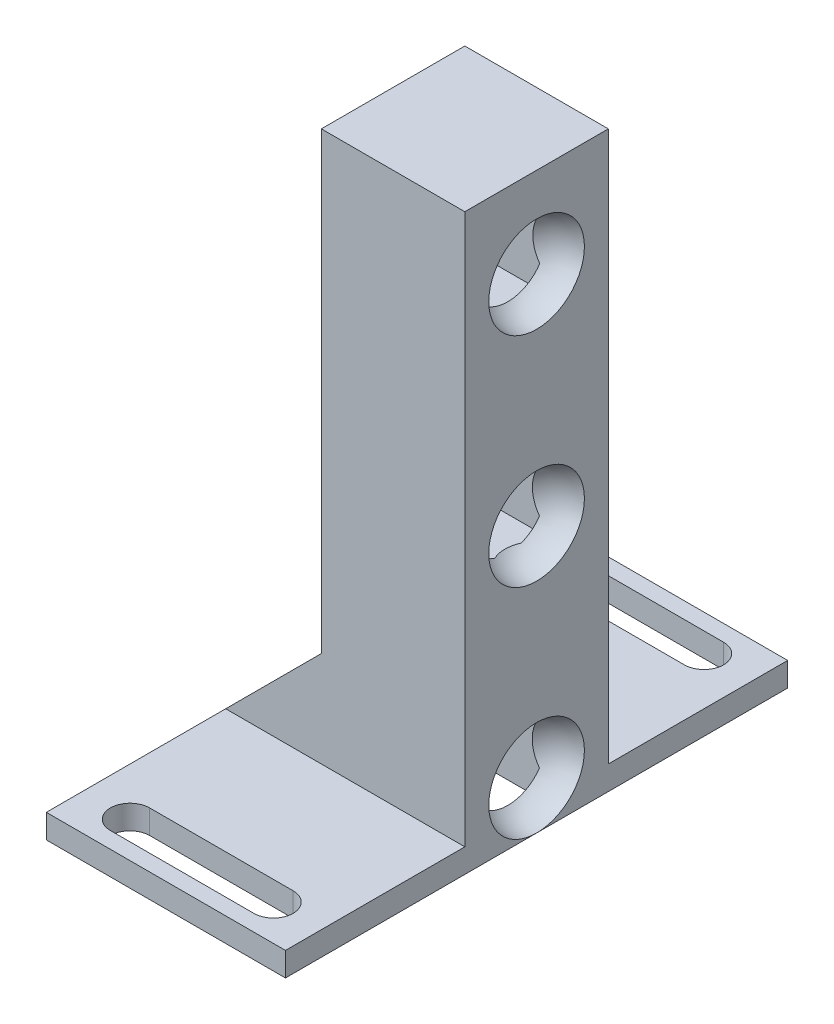
from build123d import *

# Parameters (mm, degrees)
SKETCH_1_W                      = 70
SKETCH_1_H                      = 105
EXTRUDE_1_DEPTH                 = 5
SKETCH_2_W                      = 30
SKETCH_2_H                      = 30
EXTRUDE_2_DEPTH                 = 120
EXTRUDE_3_REACH                 = 137.577
EXTRUDE_3_DIRECTION_2_REACH     = 137.577
SKETCH_8_R                      = 4.1
CUT_EXTRUDE_2_DEPTH             = 5
SKETCH_11_W                     = 20
SKETCH_11_H                     = 105
CUT_EXTRUDE_3_DEPTH             = 5
PATTERN_LINEAR_1_COUNT          = 3
PATTERN_LINEAR_1_PITCH          = 45.6
CUT_EXTRUDE_4_DEPTH             = 9
CUT_EXTRUDE_4_DEPTH_BACK        = 136.57746863
SKETCH_14_W                     = 13.2
SKETCH_14_H                     = 24
PATTERN_LINEAR_3_COUNT          = 2
PATTERN_LINEAR_3_PITCH          = 30
SKETCH_15_W                     = 30
SKETCH_15_H                     = 8.2
CUT_EXTRUDE_5_DEPTH             = 5
MIRROR_4_COPY_1_SKETCH_R        = 4.1
MIRROR_4_COPY_1_DEPTH           = 5
MIRROR_4_COPY_2_SKETCH_R        = 4.1
MIRROR_4_COPY_2_DEPTH           = 5
CUT_EXTRUDE_6_REACH             = 137.577
SKETCH_17_W                     = 13.2
SKETCH_17_H                     = 18
CUT_EXTRUDE_6_DIRECTION_2_DEPTH = 9
CUT_EXTRUDE_7_DEPTH             = 9
CUT_EXTRUDE_7_DEPTH_BACK        = 15
SKETCH_18_W                     = 13.2
SKETCH_18_H                     = 15


with BuildPart() as part:
    # 草图1 → 凸台-拉伸1 (new body)
    with BuildSketch(Plane(origin=(0, 0, 0), x_dir=(1, 0, 0), z_dir=(0, 1, 0))):
        Rectangle(SKETCH_1_W, SKETCH_1_H)
    extrude(amount=EXTRUDE_1_DEPTH)

    # 草图2 → 凸台-拉伸2 (add)
    with BuildSketch(Plane(origin=(0, 0, 0), x_dir=(1, 0, 0), z_dir=(0, 1, 0))):
        Rectangle(SKETCH_2_W, SKETCH_2_H)
    extrude(amount=EXTRUDE_2_DEPTH)

    # 凸台-拉伸3: up to this face of the body (flat: up to its plane)
    extrude_3_end = Plane(part.part.faces().sort_by_distance((0, 62.5, 15))[0])
    # 草图7 → 凸台-拉伸3 (add, up to the picked face)
    with BuildSketch(Plane.XY, mode=Mode.PRIVATE) as extrude_3_sk1:
        Polygon((-15, 25), (-35, 5), (-15, 5), align=None)
    extrude_3_tool1 = split(extrude(extrude_3_sk1.sketch, amount=EXTRUDE_3_REACH, mode=Mode.PRIVATE), bisect_by=extrude_3_end, keep=Keep.BOTH, mode=Mode.PRIVATE)
    add(extrude_3_tool1.solids().sort_by(Axis((-21.666667, 11.666667, 0), (0, 0, 1)))[0])

    # 凸台-拉伸3 direction 2: up to this face of the body (flat: up to its plane)
    extrude_3_direction_2_end = Plane(part.part.faces().sort_by_distance((0, 62.5, -15))[0])
    # 草图7 → 凸台-拉伸3 direction 2 (add, up to the picked face)
    with BuildSketch(Plane.XY, mode=Mode.PRIVATE) as extrude_3_direction_2_sk1:
        Polygon((-15, 25), (-35, 5), (-15, 5), align=None)
    extrude_3_direction_2_tool1 = split(extrude(extrude_3_direction_2_sk1.sketch, amount=-EXTRUDE_3_DIRECTION_2_REACH, mode=Mode.PRIVATE), bisect_by=extrude_3_direction_2_end, keep=Keep.BOTH, mode=Mode.PRIVATE)
    add(extrude_3_direction_2_tool1.solids().sort_by(Axis((-21.666667, 11.666667, 0), (0, 0, -1)))[0])

    # 草图8 → 切除-拉伸2 (cut)
    with BuildSketch(Plane(origin=(0, 0, 0), x_dir=(1, 0, 0), z_dir=(0, 1, 0))):
        with Locations(Location((-25, 45, 0), (0, 0, 270))):
            Circle(SKETCH_8_R)
    cut_extrude_2 = extrude(amount=CUT_EXTRUDE_2_DEPTH, mode=Mode.SUBTRACT)

    # 镜向2: 切除-拉伸2 across plane
    add(cut_extrude_2.mirror(Plane.XY), mode=Mode.SUBTRACT)

    # 草图11 → 切除-拉伸3 (cut)
    with BuildSketch(Plane(origin=(0, 0, 0), x_dir=(1, 0, 0), z_dir=(0, 1, 0))):
        with Locations((25, 0)):
            Rectangle(SKETCH_11_W, SKETCH_11_H)
    extrude(amount=CUT_EXTRUDE_3_DEPTH, mode=Mode.SUBTRACT)

    # 草图12 → 切除-旋转2 (revolve, cut)
    with BuildSketch(Plane.XY):
        with BuildLine():
            Line((15, 20), (15, 0))
            ThreePointArc((15, 0), (5, 10), (15, 20))
        make_face()
    cut_revolve_2 = revolve(axis=Axis((15, 20, 0), (0, -1, 0)), mode=Mode.SUBTRACT)

    # 阵列(线性)1: 切除-旋转2 ×3
    with Locations(*[(0, i * PATTERN_LINEAR_1_PITCH, 0) for i in range(1, PATTERN_LINEAR_1_COUNT)]):
        add(cut_revolve_2, mode=Mode.SUBTRACT)

    # 草图14 → 切除-拉伸4 (cut, two sides: drawn at the far end of the back side and taken through both)
    with BuildSketch(Plane(origin=(0, 0, 0), x_dir=(0, 0, -1), z_dir=(1, 0, 0)).offset(-CUT_EXTRUDE_4_DEPTH_BACK)):
        with Locations((0.067878733, 103.977253559)):
            Rectangle(SKETCH_14_W, SKETCH_14_H)
    extrude(amount=CUT_EXTRUDE_4_DEPTH + CUT_EXTRUDE_4_DEPTH_BACK, mode=Mode.SUBTRACT)

    # 阵列(线性)3: 切除-拉伸2 ×2
    with Locations(*[(i * PATTERN_LINEAR_3_PITCH, 0, 0) for i in range(1, PATTERN_LINEAR_3_COUNT)]):
        add(cut_extrude_2, mode=Mode.SUBTRACT)

    # 草图15 → 切除-拉伸5 (cut)
    with BuildSketch(Plane(origin=(0, 0, 0), x_dir=(1, 0, 0), z_dir=(0, 1, 0))):
        with Locations((-10, 45)):
            Rectangle(SKETCH_15_W, SKETCH_15_H)
    cut_extrude_5 = extrude(amount=CUT_EXTRUDE_5_DEPTH, mode=Mode.SUBTRACT)

    # 镜向3: 切除-拉伸5 across plane
    add(cut_extrude_5.mirror(Plane.XY), mode=Mode.SUBTRACT)

    # 镜向4 copy 1 sketch → 镜向4 copy 1 (cut)
    with BuildSketch(Plane(origin=(30, 0, 0), x_dir=(1, 0, 0), z_dir=(0, 1, 0))):
        with Locations((-25, -45)):
            Circle(MIRROR_4_COPY_1_SKETCH_R)
    extrude(amount=MIRROR_4_COPY_1_DEPTH, mode=Mode.SUBTRACT)

    # 镜向4 copy 2 sketch → 镜向4 copy 2 (cut)
    with BuildSketch(Plane(origin=(0, 0, 0), x_dir=(1, 0, 0), z_dir=(0, 1, 0))):
        with Locations((-25, -45)):
            Circle(MIRROR_4_COPY_2_SKETCH_R)
    extrude(amount=MIRROR_4_COPY_2_DEPTH, mode=Mode.SUBTRACT)

    # 切除-拉伸6: up to this plane
    cut_extrude_6_end = Plane(origin=(-15, 25, 43.284271247), z_dir=(0.7071067811865476, -0.7071067811865475, 0))
    # 草图17 → 切除-拉伸6 (cut, up to the surface)
    with BuildSketch(Plane(origin=(0, 0, 0), x_dir=(0, 0, -1), z_dir=(1, 0, 0)), mode=Mode.PRIVATE) as cut_extrude_6_sk1:
        with Locations((0, 9)):
            Rectangle(SKETCH_17_W, SKETCH_17_H)
    cut_extrude_6_tool1 = split(extrude(cut_extrude_6_sk1.sketch, amount=-CUT_EXTRUDE_6_REACH, mode=Mode.PRIVATE), bisect_by=cut_extrude_6_end, keep=Keep.BOTH, mode=Mode.PRIVATE)
    add(cut_extrude_6_tool1.solids().sort_by_distance((0, 9, 0))[0], mode=Mode.SUBTRACT)

    # 草图17 → 切除-拉伸6 direction 2 (cut)
    with BuildSketch(Plane(origin=(0, 0, 0), x_dir=(0, 0, -1), z_dir=(1, 0, 0))):
        with Locations((0, 9)):
            Rectangle(SKETCH_17_W, SKETCH_17_H)
    extrude(amount=CUT_EXTRUDE_6_DIRECTION_2_DEPTH, mode=Mode.SUBTRACT)

    # 草图18 → 切除-拉伸7 (cut, two sides: drawn at the far end of the back side and taken through both)
    with BuildSketch(Plane(origin=(0, 0, 0), x_dir=(0, 0, -1), z_dir=(1, 0, 0)).offset(-CUT_EXTRUDE_7_DEPTH_BACK)):
        with Locations((0.014378278, 55.6)):
            Rectangle(SKETCH_18_W, SKETCH_18_H)
    extrude(amount=CUT_EXTRUDE_7_DEPTH + CUT_EXTRUDE_7_DEPTH_BACK, mode=Mode.SUBTRACT)


solid = part.part
